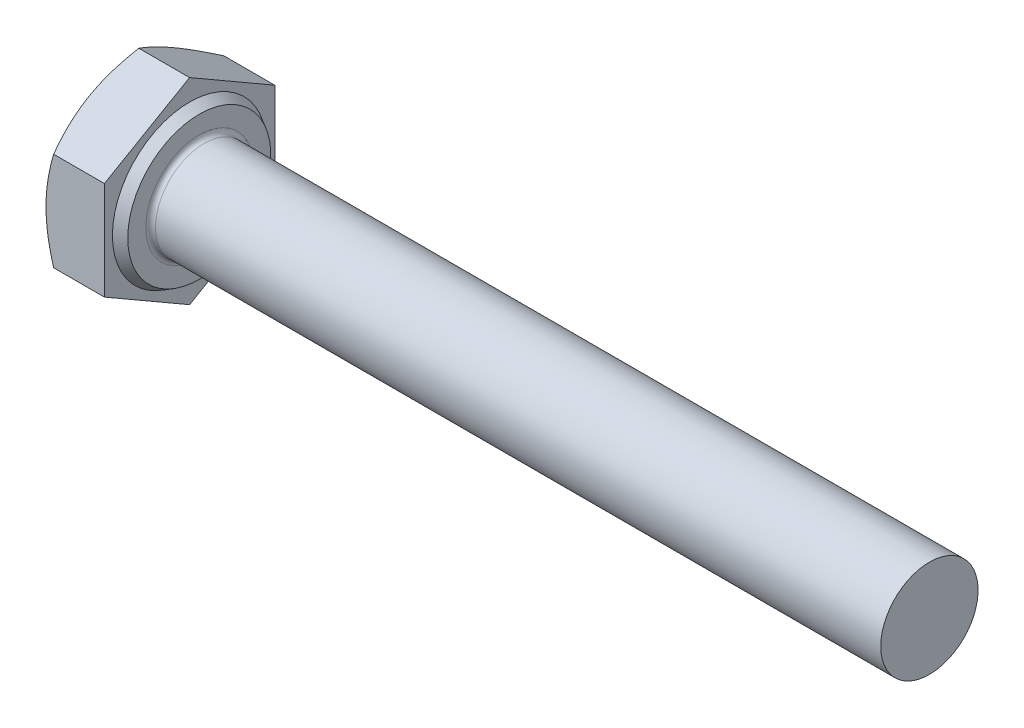
from build123d import *

# Parameters (mm, degrees)
EXTRUDE_384_DEPTH = 2.8
FILLET_1305_R     = 0.2


with BuildPart() as part:
    # 草图1 → Extrude 384 (new body)
    with BuildSketch(Plane(origin=(0, 0, 0), x_dir=(0, 0, -1), z_dir=(1, 0, 0))):
        Polygon((3.5, 2.020725942), (3.5, -2.020725942), (0, -4.041451884), (-3.5, -2.020725942), (-3.5, 2.020725942), (0, 4.041451884), align=None)
    extrude(amount=EXTRUDE_384_DEPTH)

    # 草图2 → 凸台-旋转1 (revolve)
    with BuildSketch(Plane.XY, mode=Mode.PRIVATE) as revolve_1_sk:
        Polygon((0, 0), (32.8, 0), (32.8, 1.3938), (32.8, 2), (18.8, 2), (0, 2), align=None)
    revolve(revolve_1_sk.sketch.rotate(Axis((0, 0, 0), (1, 0, 0)), 90), axis=Axis((0, 0, 0), (1, 0, 0)))

    # 草图3 → 切除-旋转1 (revolve, cut)
    with BuildSketch(Plane.XY):
        Polygon((0, 3.5), (3.199358737, 9.041451884), (3.199358737, 14.041451884), (-10, 14.041451884), (-10, 3.5), align=None)
    revolve(axis=Axis((0, 0, 0), (1, 0, 0)), mode=Mode.SUBTRACT)

    # 草图4 → 切除-旋转3 (revolve, cut)
    with BuildSketch(Plane.XY, mode=Mode.PRIVATE) as cut_revolve_3_sk:
        Polygon((2.8, 2.94), (2.4, 3.170940108), (2.4, 4.041451884), (2.8, 4.041451884), align=None)
    revolve(cut_revolve_3_sk.sketch.rotate(Axis((0, 0, 0), (1, 0, 0)), 90), axis=Axis((0, 0, 0), (1, 0, 0)), mode=Mode.SUBTRACT)

    # Fillet 1305
    fillet_1305_edges = [part.edges().sort_by_distance(p)[0] for p in [
        (2.8, 0, -2),
    ]]
    fillet(fillet_1305_edges, radius=FILLET_1305_R)


solid = part.part
